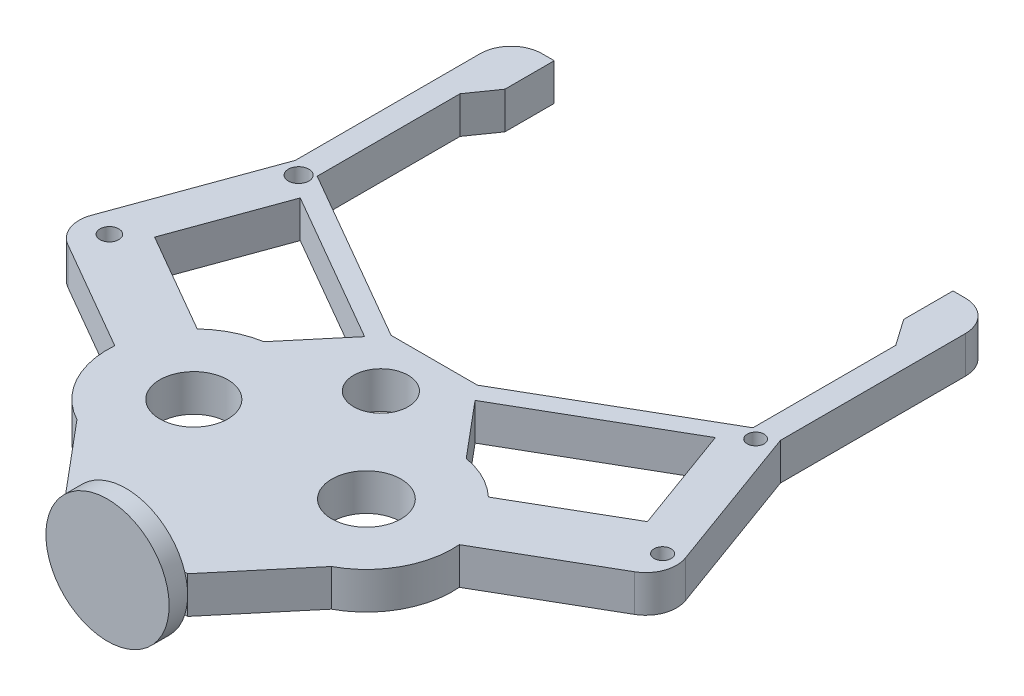
from build123d import *

# Parameters (mm, degrees)
SKETCH_1_R      = 5.517972707
SKETCH_1_R_2    = 5.611863705
SKETCH_1_R_3    = 1.527148593
SKETCH_1_R_4    = 1.382615372
SKETCH_1_R_5    = 1.672120879
SKETCH_1_R_6    = 1.371563178
SKETCH_1_R_7    = 4.42854447
EXTRUDE_1_DEPTH = 6
SKETCH_2_R      = 10
EXTRUDE_2_DEPTH = 3
FILLET_1_R      = 5


with BuildPart() as part:
    # 草图1 → 凸台-拉伸1 (new body)
    with BuildSketch(Plane(origin=(0, 0, 0), x_dir=(1, 0, 0), z_dir=(0, 1, 0))):
        with BuildLine():
            Line((-10, 0), (10, 0))
            Line((10, 0), (20.63165677, 12.67031515))
            ThreePointArc((20.63165677, 12.67031515), (26.297438403, 18.308736388), (27.95445115, 26.128402898))
            Line((27.95445115, 26.128402898), (49.605086245, 38.628402898))
            Line((49.605086245, 38.628402898), (39.344481945, 66.819181521))
            Line((39.344481945, 66.819181521), (39.344481945, 101.819181521))
            Line((39.344481945, 101.819181521), (32.344481945, 101.819181521))
            Line((32.344481945, 101.819181521), (32.344481945, 93.819181521))
            Line((32.344481945, 93.819181521), (35.344481945, 89.534737501))
            Line((35.344481945, 89.534737501), (35.344481945, 66.364694281))
            Line((35.344481945, 66.364694281), (7, 50))
            Line((7, 50), (-7, 50))
            Line((-7, 50), (-35.344481945, 66.364694281))
            Line((-35.344481945, 66.364694281), (-35.344481945, 89.534737501))
            Line((-35.344481945, 89.534737501), (-32.344481945, 93.819181521))
            Line((-32.344481945, 93.819181521), (-32.344481945, 101.819181521))
            Line((-32.344481945, 101.819181521), (-39.344481945, 101.819181521))
            Line((-39.344481945, 101.819181521), (-39.344481945, 66.819181521))
            Line((-39.344481945, 66.819181521), (-49.605086245, 38.628402898))
            Line((-49.605086245, 38.628402898), (-27.95445115, 26.128402898))
            ThreePointArc((-27.95445115, 26.128402898), (-26.297438403, 18.308736388), (-20.63165677, 12.67031515))
            Line((-20.63165677, 12.67031515), (-10, 0))
        make_face()
        with Locations(Location((-14, 25, 0), (0, 0, 270))):
            Circle(SKETCH_1_R, mode=Mode.SUBTRACT)
        with Locations(Location((14, 25, 0), (0, 0, 270))):
            Circle(SKETCH_1_R_2, mode=Mode.SUBTRACT)
        with Locations(Location((-44.044259413, 41.350104136, 0), (0, 0, 270))):
            Circle(SKETCH_1_R_3, mode=Mode.SUBTRACT)
        with Locations(Location((45.704626141, 41.350104136, 0), (0, 0, 270))):
            Circle(SKETCH_1_R_4, mode=Mode.SUBTRACT)
        with Locations(Location((-37.005131134, 65.009396406, 0), (0, 0, 270))):
            Circle(SKETCH_1_R_5, mode=Mode.SUBTRACT)
        with Locations(Location((37.145951464, 65.009396406, 0), (0, 0, 270))):
            Circle(SKETCH_1_R_6, mode=Mode.SUBTRACT)
        with Locations(Location((0, 41.350104136, 0), (0, 0, 270))):
            Circle(SKETCH_1_R_7, mode=Mode.SUBTRACT)
        with BuildLine():
            Line((8.958110934, 47.66641426), (16.404682223, 38.791936173))
            ThreePointArc((16.404682223, 38.791936173), (20.278324988, 37.51329834), (23.618950039, 35.172305548))
            Line((23.618950039, 35.172305548), (39.976426, 44.616298697))
            Line((39.976426, 44.616298697), (33.672776585, 61.935433126))
            Line((33.672776585, 61.935433126), (8.958110934, 47.66641426))
        make_face(mode=Mode.SUBTRACT)
        with BuildLine():
            Line((-8.958110934, 47.66641426), (-16.404682223, 38.791936173))
            ThreePointArc((-16.404682223, 38.791936173), (-20.278324988, 37.51329834), (-23.618950039, 35.172305548))
            Line((-23.618950039, 35.172305548), (-39.976426, 44.616298697))
            Line((-39.976426, 44.616298697), (-33.672776585, 61.935433126))
            Line((-33.672776585, 61.935433126), (-8.958110934, 47.66641426))
        make_face(mode=Mode.SUBTRACT)
    extrude(amount=EXTRUDE_1_DEPTH)

    # 草图2 → 凸台-拉伸2 (add)
    with BuildSketch(Plane.XY):
        with Locations((0, 3)):
            Circle(SKETCH_2_R)
    extrude(amount=EXTRUDE_2_DEPTH)

    # 圆角1
    fillet_1_edges = [part.edges().sort_by_distance(p)[0] for p in [
        (-49.605086245, 3, -38.628402898),
        (-39.344481945, 3, -101.819181521),
        (39.344481945, 3, -101.819181521),
        (49.605086245, 3, -38.628402898),
    ]]
    fillet(fillet_1_edges, radius=FILLET_1_R)


solid = part.part
